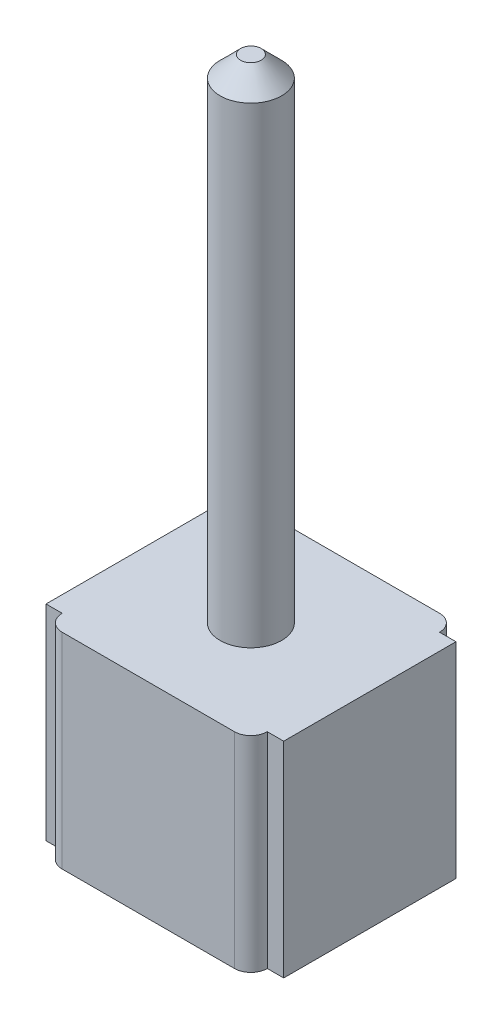
from build123d import *

# Parameters (mm, degrees)
BOSS_EXTRU_1_DEPTH = 2.5
ESQUISSE3_R        = 0.375
BOSS_EXTRU_2_DEPTH = 6
CHANFREIN1_SIZE    = 0.25
BOSS_EXTRU_3_DEPTH = 0.2
CONG_1_R           = 0.15
CONG_2_R           = 0.15


with BuildPart() as part:
    # Esquisse1 → Boss.-Extru.1 (new body)
    with BuildSketch(Plane(origin=(0, 0, 0), x_dir=(1, 0, 0), z_dir=(0, 1, 0))):
        with BuildLine():
            Line((-1.25, 1.05), (-1.446931313, 1.05))
            Line((-1.446931313, 1.05), (-1.446931313, -1.05))
            Line((-1.446931313, -1.05), (-1.25, -1.05))
            ThreePointArc((-1.25, -1.05), (-1.191421356, -1.191421356), (-1.05, -1.25))
            Line((-1.05, -1.25), (1.05, -1.25))
            ThreePointArc((1.05, -1.25), (1.191421356, -1.191421356), (1.25, -1.05))
            Line((1.25, -1.05), (1.449962609, -1.05))
            Line((1.449962609, -1.05), (1.449962609, 1.05))
            Line((1.449962609, 1.05), (1.25, 1.05))
            ThreePointArc((1.25, 1.05), (1.191421356, 1.191421356), (1.05, 1.25))
            Line((1.05, 1.25), (-1.05, 1.25))
            ThreePointArc((-1.05, 1.25), (-1.191421356, 1.191421356), (-1.25, 1.05))
        make_face()
    extrude(amount=BOSS_EXTRU_1_DEPTH)

    # Esquisse3 → Boss.-Extru.2 (add)
    with BuildSketch(Plane(origin=(0, 2.5, 0), x_dir=(1, 0, 0), z_dir=(0, 1, 0))):
        with Locations(Location((0, 0, 0), (0, 0, 90))):
            Circle(ESQUISSE3_R)
    extrude(amount=BOSS_EXTRU_2_DEPTH)

    # Chanfrein1
    chanfrein1_edges = [part.edges().sort_by_distance(p)[0] for p in [
        (0, 8.5, 0.375),
    ]]
    chamfer(chanfrein1_edges, length=CHANFREIN1_SIZE)

    # Esquisse4 → Boss.-Extru.3 (add)
    with BuildSketch(Plane.XZ):
        Polygon((0, 0), (0.304241832, 0), (0.304241832, -2.250938438), (0, -2.250938438), (-0.299312937, -2.250938438), (-0.299312937, 0), align=None)
    extrude(amount=BOSS_EXTRU_3_DEPTH)

    # Congé1
    cong_1_edges = [part.edges().sort_by_distance(p)[0] for p in [
        (0.002464447, 0, -2.250938438),
    ]]
    fillet(cong_1_edges, radius=CONG_1_R)

    # Congé2
    cong_2_edges = [part.edges().sort_by_distance(p)[0] for p in [
        (-0.299312937, 0, -1.675469219),
        (-0.299312937, -0.175, -2.250938438),
        (0.304241832, -0.175, -2.250938438),
        (0.304241832, 0, -1.675469219),
        (0.304241832, -0.043933983, -2.207004455),
        (-0.299312937, -0.043933983, -2.207004455),
    ]]
    fillet(cong_2_edges, radius=CONG_2_R)


solid = part.part
